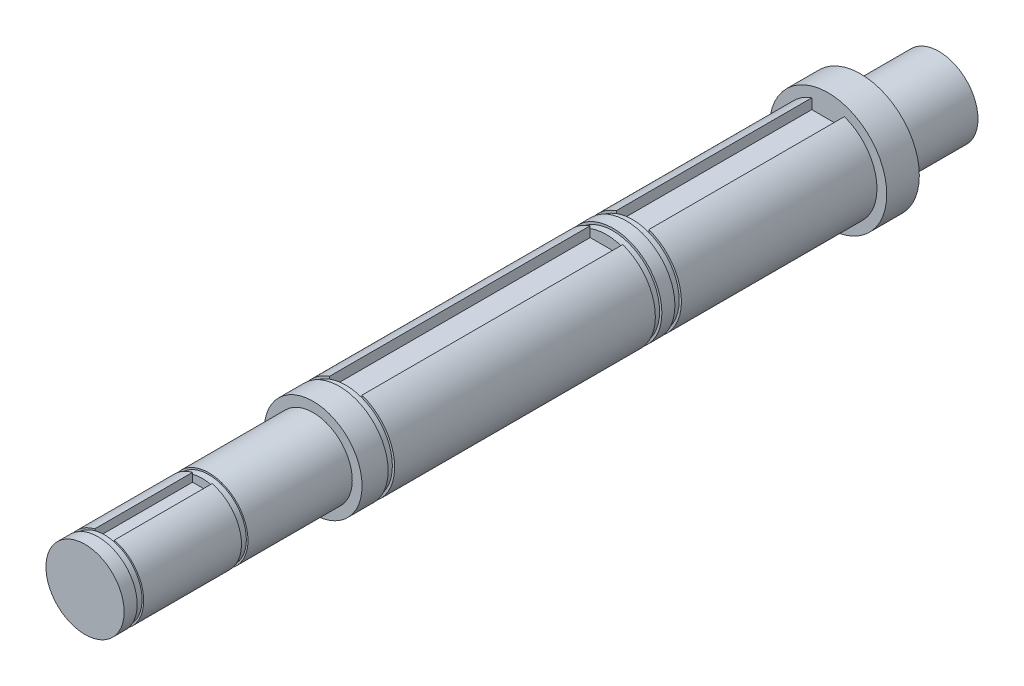
from build123d import *

# Parameters (mm, degrees)
CUT_EXTRUDE2_START  = -16
SKETCH7_R           = 10.15
SKETCH7_R_2         = 7.15
CUT_EXTRUDE2_DEPTH  = 1
SKETCH10_W          = 5
SKETCH10_H          = 3
CUT_EXTRUDE3_DEPTH  = 40
SKETCH11_R          = 10.15
SKETCH11_R_2        = 7.15
CUT_EXTRUDE4_DEPTH  = 1
CUT_EXTRUDE5_START  = -3
SKETCH13_R          = 10.15
SKETCH13_R_2        = 7.15
CUT_EXTRUDE5_DEPTH  = 1
CUT_EXTRUDE6_START  = -61
SKETCH14_W          = 5
SKETCH14_H          = 3
CUT_EXTRUDE6_DEPTH  = 30
SKETCH15_R          = 6
BOSS_EXTRUDE4_DEPTH = 20
SKETCH16_W          = 3
SKETCH16_H          = 1.5
CUT_EXTRUDE7_DEPTH  = 15
SKETCH17_R          = 6
BOSS_EXTRUDE5_DEPTH = 3
SKETCH18_R          = 6.5
SKETCH18_R_2        = 5.75
CUT_EXTRUDE8_DEPTH  = 1
CUT_EXTRUDE9_START  = -1
SKETCH19_R          = 6.5
SKETCH19_R_2        = 5.75
CUT_EXTRUDE9_DEPTH  = 1


with BuildPart() as part:
    # Sketch5 → Revolve1 (revolve)
    with BuildSketch(Plane(origin=(0, 0, 0), x_dir=(0, 0, -1), z_dir=(1, 0, 0)), mode=Mode.PRIVATE) as revolve1_sk:
        Polygon((0, 0), (0, 6), (12, 6), (12, 7.5), (91, 7.5), (91, 9), (96, 9), (96, 6), (108, 6), (108, 0), align=None)
    revolve(revolve1_sk.sketch.rotate(Axis((0, 0, 0), (0, 0, -1)), 90), axis=Axis((0, 0, 0), (0, 0, -1)))

    # Sketch7 → Cut-Extrude2 (cut)
    with BuildSketch(Plane.XY.offset(CUT_EXTRUDE2_START)):
        Circle(SKETCH7_R)
        Circle(SKETCH7_R_2, mode=Mode.SUBTRACT)
    extrude(amount=-CUT_EXTRUDE2_DEPTH, mode=Mode.SUBTRACT)

    # Sketch10 → Cut-Extrude3 (cut)
    with BuildSketch(Plane.XY.offset(-17)):
        with Locations((0, 7)):
            Rectangle(SKETCH10_W, SKETCH10_H)
    extrude(amount=-CUT_EXTRUDE3_DEPTH, mode=Mode.SUBTRACT)

    # Sketch11 → Cut-Extrude4 (cut)
    with BuildSketch(Plane.XY.offset(-57)):
        Circle(SKETCH11_R)
        Circle(SKETCH11_R_2, mode=Mode.SUBTRACT)
    extrude(amount=-CUT_EXTRUDE4_DEPTH, mode=Mode.SUBTRACT)

    # Sketch13 → Cut-Extrude5 (cut)
    with BuildSketch(Plane.XY.offset(-57).offset(CUT_EXTRUDE5_START)):
        Circle(SKETCH13_R)
        Circle(SKETCH13_R_2, mode=Mode.SUBTRACT)
    extrude(amount=-CUT_EXTRUDE5_DEPTH, mode=Mode.SUBTRACT)

    # Sketch14 → Cut-Extrude6 (cut)
    with BuildSketch(Plane.XY.offset(CUT_EXTRUDE6_START)):
        with Locations((0, 7)):
            Rectangle(SKETCH14_W, SKETCH14_H)
    extrude(amount=-CUT_EXTRUDE6_DEPTH, mode=Mode.SUBTRACT)

    # Sketch15 → Boss-Extrude4 (add)
    with BuildSketch(Plane.XY):
        Circle(SKETCH15_R)
    extrude(amount=BOSS_EXTRUDE4_DEPTH)

    # Sketch16 → Cut-Extrude7 (cut)
    with BuildSketch(Plane.XY.offset(20)):
        with Locations((0, 5.25)):
            Rectangle(SKETCH16_W, SKETCH16_H)
    extrude(amount=-CUT_EXTRUDE7_DEPTH, mode=Mode.SUBTRACT)

    # Sketch17 → Boss-Extrude5 (add)
    with BuildSketch(Plane.XY.offset(20)):
        Circle(SKETCH17_R)
    extrude(amount=BOSS_EXTRUDE5_DEPTH)

    # Sketch18 → Cut-Extrude8 (cut)
    with BuildSketch(Plane(origin=(0, 0, 20), x_dir=(-1, 0, 0), z_dir=(0, 0, -1))):
        Circle(SKETCH18_R)
        Circle(SKETCH18_R_2, mode=Mode.SUBTRACT)
    extrude(amount=-CUT_EXTRUDE8_DEPTH, mode=Mode.SUBTRACT)

    # Sketch19 → Cut-Extrude9 (cut)
    with BuildSketch(Plane.XY.offset(5).offset(CUT_EXTRUDE9_START)):
        Circle(SKETCH19_R)
        Circle(SKETCH19_R_2, mode=Mode.SUBTRACT)
    extrude(amount=CUT_EXTRUDE9_DEPTH, mode=Mode.SUBTRACT)


solid = part.part
